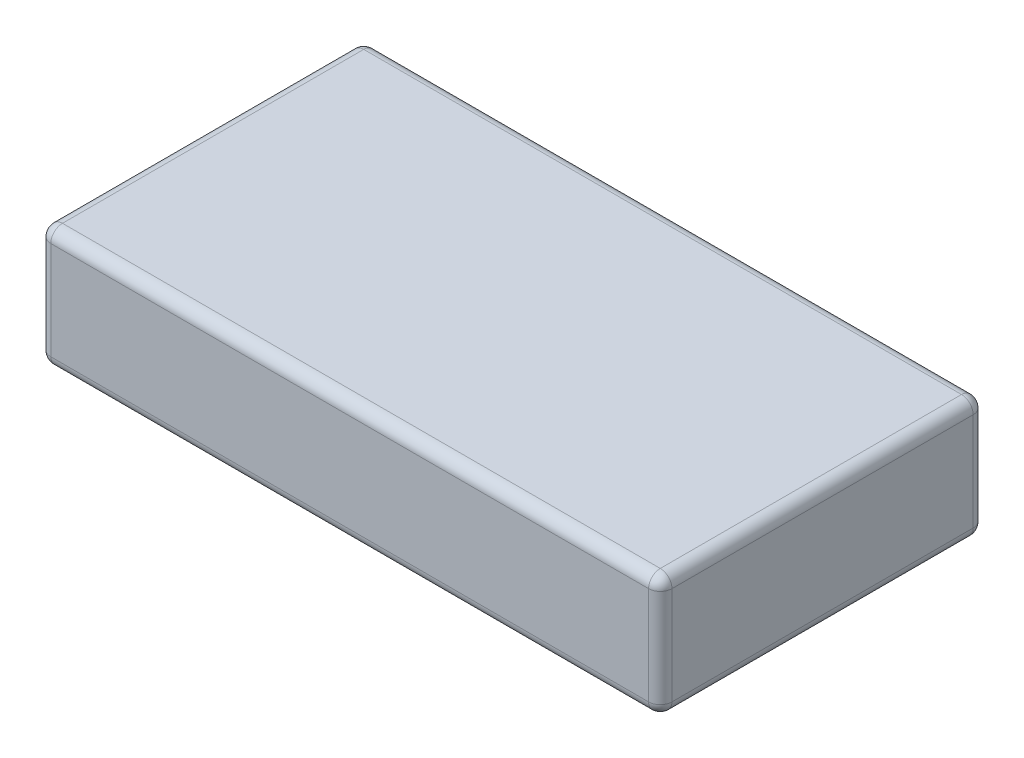
from build123d import *

# Parameters (mm, degrees)
SKETCH_1_W      = 53.2
SKETCH_1_H      = 27.8
EXTRUDE_1_DEPTH = 10.4
FILLET_1_R      = 1


with BuildPart() as part:
    # 草图1 → 凸台-拉伸1 (new body)
    with BuildSketch(Plane(origin=(0, 0, 0), x_dir=(1, 0, 0), z_dir=(0, 1, 0))):
        Rectangle(SKETCH_1_W, SKETCH_1_H)
    extrude(amount=EXTRUDE_1_DEPTH)

    # 圆角1
    fillet_1_edges = [part.edges().sort_by_distance(p)[0] for p in [
        (-26.6, 10.4, 0),
        (0, 10.4, 13.9),
        (26.6, 10.4, 0),
        (0, 0, 13.9),
        (-26.6, 0, 0),
        (0, 0, -13.9),
        (26.6, 0, 0),
        (26.6, 5.2, 13.9),
        (-26.6, 5.2, 13.9),
        (-26.6, 5.2, -13.9),
        (26.6, 5.2, -13.9),
        (0, 10.4, -13.9),
    ]]
    fillet(fillet_1_edges, radius=FILLET_1_R)


solid = part.part
